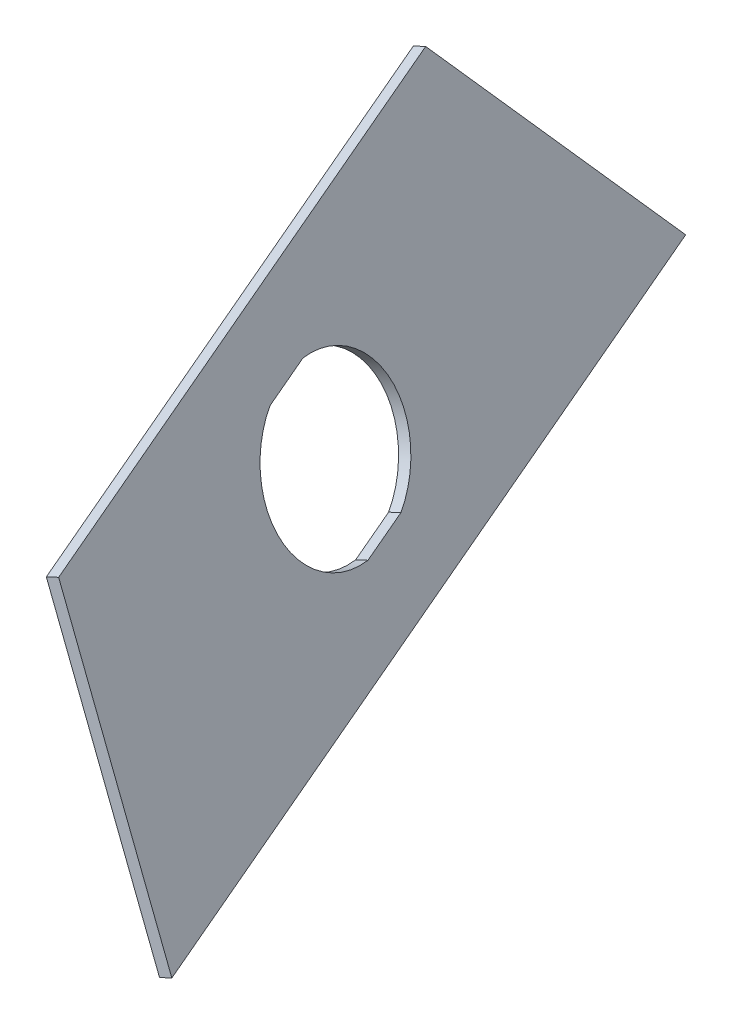
from build123d import *

# Parameters (mm, degrees)
BOSS_EXTRUDE1_DEPTH = 1.5875


with BuildPart() as part:
    # Sketch40 → Boss-Extrude1 (new body)
    with BuildSketch(Plane(origin=(-456.955039877, 178.120588246, -67.48659487), x_dir=(-0.12701055438256242, 0.04950857893190618, 0.9906650390962515), z_dir=(-0.9230204054682252, 0.3597923717602286, -0.13631867191409483))):
        Polygon((-143.227084656, 906.623268698), (-170.661347691, 874.056453533), (-74.641427067, 839.002915601), (-74.641427067, 881.585027318), align=None)
        with BuildLine():
            Line((-115.271977523, 886.304578524), (-109.11217167, 884.055847358))
            ThreePointArc((-109.11217167, 884.055847358), (-105.459844174, 871.54470512), (-116.313665717, 864.329254051))
            Line((-116.313665717, 864.329254051), (-122.47347157, 866.577985217))
            ThreePointArc((-122.47347157, 866.577985217), (-126.125799067, 879.089127455), (-115.271977523, 886.304578524))
        make_face(mode=Mode.SUBTRACT)
    extrude(amount=BOSS_EXTRUDE1_DEPTH)


with BuildPart() as body_2:
    # Mirror2: mirrored copy
    add(part.part.mirror(Plane(origin=(0, 0, 0), x_dir=(0, 0, 1), z_dir=(1, 0, 0))))


solid = body_2.part
